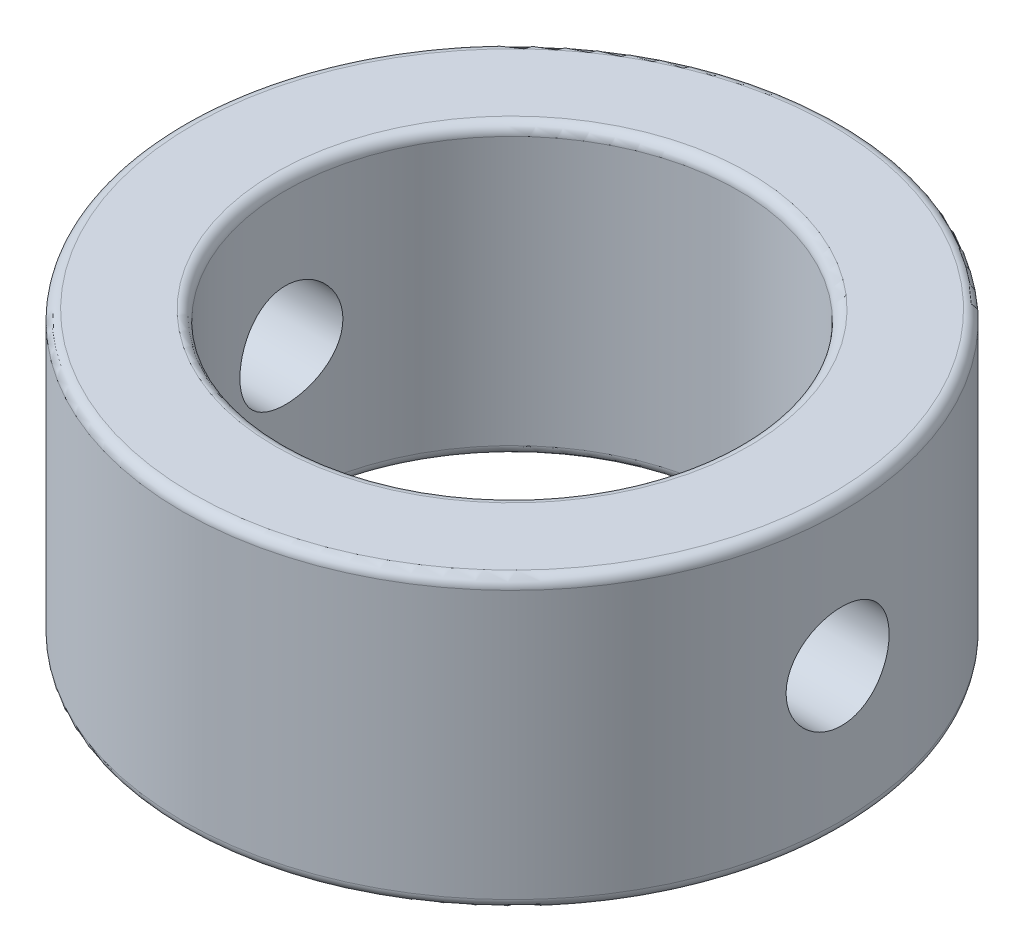
from build123d import *

# Parameters (mm, degrees)
SKETCH1_R               = 16
SKETCH1_R_2             = 11
BOSS_EXTRUDE1_DEPTH     = 7
CUT_EXTRUDE1_DEPTH      = 24.685438565
CUT_EXTRUDE1_DEPTH_BACK = 24.685438565
SKETCH2_R               = 2.5
FILLET1_R               = 0.5


with BuildPart() as part:
    # Sketch1 → Boss-Extrude1 (new, symmetric)
    with BuildSketch(Plane(origin=(0, 0, 0), x_dir=(1, 0, 0), z_dir=(0, 1, 0))):
        with Locations(Location((0, 0, 0), (0, 0, 270))):
            Circle(SKETCH1_R)
        with Locations(Location((0, 0, 0), (0, 0, 270))):
            Circle(SKETCH1_R_2, mode=Mode.SUBTRACT)
    extrude(amount=BOSS_EXTRUDE1_DEPTH, both=True)

    # Sketch2 → Cut-Extrude1 (cut, two sides: drawn at the far end of the back side and taken through both)
    with BuildSketch(Plane(origin=(0, 0, 0), x_dir=(0, 0, -1), z_dir=(1, 0, 0)).offset(-CUT_EXTRUDE1_DEPTH_BACK)):
        Circle(SKETCH2_R)
    extrude(amount=CUT_EXTRUDE1_DEPTH + CUT_EXTRUDE1_DEPTH_BACK, mode=Mode.SUBTRACT)

    # Fillet1
    fillet1_edges = [part.edges().sort_by_distance(p)[0] for p in [
        (0, -7, -16),
        (0, 7, -16),
        (0, -7, -11),
        (0, 7, -11),
    ]]
    fillet(fillet1_edges, radius=FILLET1_R)


solid = part.part
